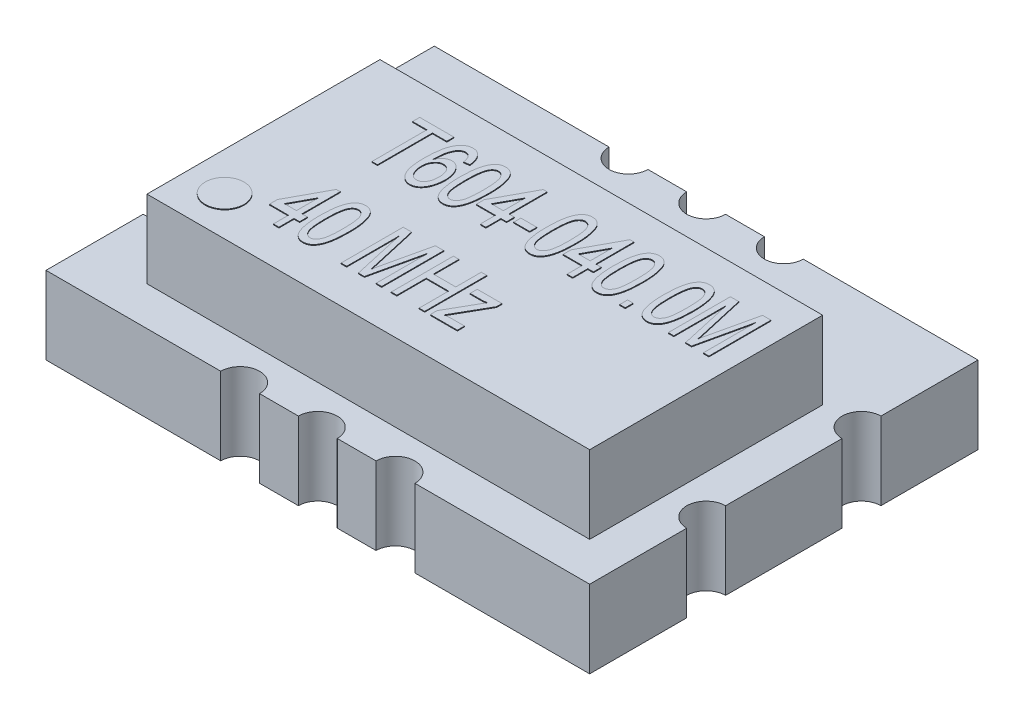
from build123d import *

# Parameters (mm, degrees)
SKETCH_327_W        = 7
SKETCH_327_H        = 5
EXTRUDE_754_DEPTH   = 1
SKETCH_2_R          = 0.25
CUT_EXTRUDE_1_DEPTH = 1
SKETCH_3_W          = 5.7
SKETCH_3_H          = 3
EXTRUDE_1543_DEPTH  = 1
SKETCH_4_R          = 0.25
EXTRUDE_1724_DEPTH  = 0.01
SKETCH_5_W          = 0.205128205
SKETCH_5_H          = 0.092307692
SKETCH_5_W_2        = 0.071794871
SKETCH_5_H_2        = 0.102564102
EXTRUDE_1953_DEPTH  = 0.01


with BuildPart() as part:
    # Sketch 327 → Extrude 754 (new body)
    with BuildSketch(Plane(origin=(0, 0, 0), x_dir=(1, 0, 0), z_dir=(0, 1, 0))):
        Rectangle(SKETCH_327_W, SKETCH_327_H)
    extrude(amount=EXTRUDE_754_DEPTH)

    # Эскиз2 → Вырез-Вытянуть1 (cut)
    with BuildSketch(Plane(origin=(0, 1, 0), x_dir=(1, 0, 0), z_dir=(0, 1, 0))):
        with Locations((0, 2.5)):
            Circle(SKETCH_2_R)
        with Locations((-1, 2.5)):
            Circle(SKETCH_2_R)
        with Locations((1, 2.5)):
            Circle(SKETCH_2_R)
        with Locations((1, -2.5)):
            Circle(SKETCH_2_R)
        with Locations((0, -2.5)):
            Circle(SKETCH_2_R)
        with Locations((-1, -2.5)):
            Circle(SKETCH_2_R)
        with Locations((-3.5, 1)):
            Circle(SKETCH_2_R)
        with Locations((-3.5, -1)):
            Circle(SKETCH_2_R)
        with Locations((3.5, -1)):
            Circle(SKETCH_2_R)
        with Locations((3.5, 1)):
            Circle(SKETCH_2_R)
    extrude(amount=-CUT_EXTRUDE_1_DEPTH, mode=Mode.SUBTRACT)

    # Эскиз3 → Extrude 1543 (add)
    with BuildSketch(Plane(origin=(0, 1, 0), x_dir=(1, 0, 0), z_dir=(0, 1, 0))):
        with Locations((0.15, -0.5)):
            Rectangle(SKETCH_3_W, SKETCH_3_H)
    extrude(amount=EXTRUDE_1543_DEPTH)

    # Эскиз4 → Extrude 1724 (add)
    with BuildSketch(Plane(origin=(0, 2, 0), x_dir=(1, 0, 0), z_dir=(0, 1, 0))):
        with Locations(Location((-2.2, -1.5, 0), (0, 0, 90))):
            Circle(SKETCH_4_R)
    extrude(amount=EXTRUDE_1724_DEPTH)

    # Эскиз5 → Extrude 1953 (add)
    # profile 1 of 16: a face of its own
    with BuildSketch(Plane(origin=(0, 2, 0), x_dir=(1, 0, 0), z_dir=(0, 1, 0))):
        Polygon((-1.605128205, -0.198447222), (-1.605128205, 0.509245086), (-1.78974359, 0.509245086), (-1.78974359, 0.601552778), (-1.348717949, 0.601552778), (-1.348717949, 0.509245086), (-1.533333333, 0.509245086), (-1.533333333, -0.198447222), align=None)
    # profile 2 of 16: a face of its own
    with BuildSketch(Plane(origin=(0, 2, 0), x_dir=(1, 0, 0), z_dir=(0, 1, 0))):
        with BuildLine():
            Line((-0.938461538, 0.396424573), (-1.01025641, 0.386168163))
            add(Edge.make_bspline(
                [(-1.01025641, 0.386168163), (-1.011829196, 0.394959963), (-1.014767432, 0.41138457), (-1.020872344, 0.433881706), (-1.027577261, 0.45278543), (-1.033724764, 0.46337337), (-1.036538462, 0.468219445)],
                knots=[0, 0, 0, 0, 1.235592023, 2.308300062, 3.225713117, 4, 4, 4, 4], degree=3))
            add(Edge.make_bspline(
                [(-1.036538462, 0.468219445), (-1.038875712, 0.471476686), (-1.043418307, 0.477807341), (-1.051163384, 0.486199852), (-1.059342177, 0.493207712), (-1.067780367, 0.499201094), (-1.076784375, 0.503640837), (-1.086196742, 0.506908305), (-1.096018408, 0.508880402), (-1.102715568, 0.509122907), (-1.106089744, 0.509245086)],
                knots=[0, 0, 0, 0, 1.141493082, 2.218563704, 3.243734935, 4.206326421, 5.159243375, 6.093006733, 7.039215068, 8, 8, 8, 8], degree=3))
            add(Edge.make_bspline(
                [(-1.106089744, 0.509245086), (-1.111571841, 0.508981991), (-1.122613654, 0.508452077), (-1.138831945, 0.503604195), (-1.154826806, 0.496246686), (-1.164532351, 0.489180963), (-1.169551282, 0.485527137)],
                knots=[0, 0, 0, 0, 0.951557446, 1.916587267, 2.922625766, 4, 4, 4, 4], degree=3))
            add(Edge.make_bspline(
                [(-1.169551282, 0.485527137), (-1.174146399, 0.479924965), (-1.183822049, 0.468128823), (-1.195746396, 0.447053466), (-1.207022635, 0.422826879), (-1.215022586, 0.400055402), (-1.221030881, 0.379743395), (-1.22474167, 0.362202268), (-1.228126456, 0.342861625), (-1.230808368, 0.321682198), (-1.232838698, 0.298691384), (-1.234412537, 0.273843567), (-1.235582622, 0.247129469), (-1.235790316, 0.228690852), (-1.235897436, 0.219180983)],
                knots=[0, 0, 0, 0, 0.929692342, 1.957595063, 3.100239194, 4.361915913, 5.055045251, 5.821294394, 6.664420891, 7.578132896, 8.563927728, 9.630270748, 10.777792499, 12, 12, 12, 12], degree=3))
            add(Edge.make_bspline(
                [(-1.235897436, 0.219180983), (-1.231663714, 0.227628807), (-1.223502301, 0.24391381), (-1.208487373, 0.265600151), (-1.192238847, 0.284042542), (-1.174524272, 0.298895457), (-1.155859895, 0.310282265), (-1.136770208, 0.318674662), (-1.117084133, 0.323698084), (-1.103766983, 0.324319379), (-1.097115385, 0.324629701)],
                knots=[0, 0, 0, 0, 1.230094978, 2.371273472, 3.426311028, 4.424565397, 5.371321406, 6.266187712, 7.134002212, 8, 8, 8, 8], degree=3))
            add(Edge.make_bspline(
                [(-1.097115385, 0.324629701), (-1.091385412, 0.32441023), (-1.079985835, 0.3239736), (-1.063208262, 0.320581649), (-1.047198176, 0.314599092), (-1.031648282, 0.306828393), (-1.017074624, 0.29632813), (-1.002955788, 0.283914017), (-0.989712602, 0.269021848), (-0.977138015, 0.252148702), (-0.965696154, 0.233468507), (-0.955512792, 0.213358165), (-0.947052029, 0.191826266), (-0.940208844, 0.168968972), (-0.934726973, 0.144885381), (-0.930917511, 0.119442532), (-0.928684932, 0.092672172), (-0.928367375, 0.074366899), (-0.928205128, 0.065014316)],
                knots=[0, 0, 0, 0, 0.803176231, 1.597890533, 2.386936835, 3.194258654, 4.027570185, 4.897800899, 5.825904207, 6.816127502, 7.845138853, 8.893621501, 9.97297987, 11.084300336, 12.236347745, 13.433391822, 14.688661128, 16, 16, 16, 16], degree=3))
            add(Edge.make_bspline(
                [(-0.928205128, 0.065014316), (-0.928474194, 0.052661832), (-0.929003551, 0.028359719), (-0.93343545, -0.007471118), (-0.940771326, -0.041957589), (-0.950963167, -0.074712527), (-0.963369928, -0.105054302), (-0.978244958, -0.132047972), (-0.9954491, -0.15530195), (-1.014934933, -0.174444913), (-1.036017972, -0.189833119), (-1.058846569, -0.200662859), (-1.083031981, -0.2076316), (-1.099739189, -0.208344006), (-1.108173077, -0.208703632)],
                knots=[0, 0, 0, 0, 1.225236238, 2.410513451, 3.575809562, 4.71909413, 5.809677918, 6.82277454, 7.769360828, 8.668837294, 9.52339245, 10.345990864, 11.165047303, 12, 12, 12, 12], degree=3))
            add(Edge.make_bspline(
                [(-1.108173077, -0.208703632), (-1.115351429, -0.208421561), (-1.129511015, -0.207865163), (-1.150250762, -0.203581577), (-1.169945747, -0.196501298), (-1.188575139, -0.186498054), (-1.206340875, -0.174022579), (-1.222762943, -0.158277789), (-1.238289006, -0.139975991), (-1.252857691, -0.118814317), (-1.265893984, -0.094330462), (-1.27723161, -0.066360278), (-1.28653283, -0.034698727), (-1.294360231, 0.000471378), (-1.300347679, 0.03928949), (-1.304531341, 0.081714659), (-1.30736846, 0.127689571), (-1.307581791, 0.159560971), (-1.307692308, 0.176072009)],
                knots=[0, 0, 0, 0, 0.715419718, 1.411193832, 2.102056538, 2.79550207, 3.513831178, 4.259984806, 5.057338898, 5.903989113, 6.816780578, 7.817864891, 8.908225659, 10.103672414, 11.408590738, 12.822241662, 14.353756468, 16, 16, 16, 16], degree=3))
            add(Edge.make_bspline(
                [(-1.307692308, 0.176072009), (-1.307522459, 0.194612442), (-1.307194777, 0.230381828), (-1.304285619, 0.282085233), (-1.299599287, 0.329855175), (-1.292924752, 0.373735612), (-1.284413263, 0.413716779), (-1.273823225, 0.449764945), (-1.261656016, 0.482095305), (-1.251169292, 0.501436943), (-1.246153846, 0.510687393)],
                knots=[0, 0, 0, 0, 1.294341645, 2.497126386, 3.61414508, 4.644286579, 5.594527563, 6.465451546, 7.266077419, 8, 8, 8, 8], degree=3))
            add(Edge.make_bspline(
                [(-1.246153846, 0.510687393), (-1.241674686, 0.517910597), (-1.232991531, 0.531913265), (-1.217553633, 0.550395366), (-1.201275897, 0.566314215), (-1.183535124, 0.579160685), (-1.164643403, 0.589157807), (-1.144622255, 0.596500668), (-1.123358941, 0.600708621), (-1.108832245, 0.601268142), (-1.101442308, 0.601552778)],
                knots=[0, 0, 0, 0, 1.134860032, 2.200002815, 3.210056974, 4.171328071, 5.116848547, 6.058803046, 7.012485358, 8, 8, 8, 8], degree=3))
            add(Edge.make_bspline(
                [(-1.101442308, 0.601552778), (-1.095930444, 0.601413704), (-1.085058337, 0.601139383), (-1.069126879, 0.598520414), (-1.053986766, 0.594153768), (-1.039574617, 0.588231275), (-1.026066383, 0.580442448), (-1.013272652, 0.571040194), (-1.00121839, 0.559931644), (-0.990053651, 0.54709687), (-0.979845892, 0.532774218), (-0.970413964, 0.517225909), (-0.962580188, 0.500135258), (-0.955375355, 0.481946398), (-0.949616762, 0.462382354), (-0.94450336, 0.441619889), (-0.940934017, 0.419470118), (-0.939299152, 0.404231824), (-0.938461538, 0.396424573)],
                knots=[0, 0, 0, 0, 0.912218998, 1.79934439, 2.664498095, 3.517124232, 4.372956603, 5.23991742, 6.141436544, 7.081787579, 8.051513077, 9.051276494, 10.088042922, 11.160755319, 12.288517567, 13.462149164, 14.699746833, 16, 16, 16, 16], degree=3))
        make_face()
        with BuildLine():
            add(Edge.make_bspline(
                [(-1.235897436, 0.06709765), (-1.235728939, 0.059074997), (-1.235395187, 0.043184075), (-1.232218983, 0.019582979), (-1.227086017, -0.003456215), (-1.22017273, -0.025702797), (-1.211480353, -0.046231165), (-1.201611231, -0.064654486), (-1.190136394, -0.080253331), (-1.177663114, -0.093557789), (-1.163510647, -0.10380965), (-1.148033716, -0.111129449), (-1.131232923, -0.115623808), (-1.119579265, -0.116134744), (-1.113621795, -0.11639594)],
                knots=[0, 0, 0, 0, 1.181504839, 2.340273327, 3.501258125, 4.656251808, 5.767206257, 6.781634005, 7.727720866, 8.612747834, 9.458148051, 10.28547701, 11.123518102, 12, 12, 12, 12], degree=3))
            add(Edge.make_bspline(
                [(-1.113621795, -0.11639594), (-1.109390217, -0.116241992), (-1.101132626, -0.115941574), (-1.089080104, -0.113578901), (-1.07760873, -0.109951055), (-1.066837647, -0.104606609), (-1.056792426, -0.097772893), (-1.047401703, -0.08945876), (-1.038602056, -0.079701503), (-1.03063513, -0.068411743), (-1.023408104, -0.055927945), (-1.01726081, -0.042234242), (-1.01165527, -0.027585142), (-1.007475273, -0.011711244), (-1.004093643, 0.005145651), (-1.001709657, 0.023078115), (-1.000262349, 0.042073488), (-1.000088798, 0.055129183), (-1, 0.061809188)],
                knots=[0, 0, 0, 0, 0.861080256, 1.680330439, 2.492180885, 3.304614139, 4.119229206, 4.95937307, 5.85282585, 6.78858546, 7.768147815, 8.785457484, 9.842190834, 10.958443789, 12.12325195, 13.341683336, 14.639860385, 16, 16, 16, 16], degree=3))
            add(Edge.make_bspline(
                [(-1, 0.061809188), (-1.000087221, 0.068222334), (-1.000257535, 0.080745017), (-1.001731125, 0.099044683), (-1.004068763, 0.116287945), (-1.007434603, 0.13246698), (-1.011813689, 0.14753722), (-1.016817361, 0.161727804), (-1.023112596, 0.174747971), (-1.030356278, 0.186621661), (-1.038281172, 0.197415669), (-1.047153193, 0.206725793), (-1.056688122, 0.214781515), (-1.067163819, 0.22113733), (-1.078384015, 0.226258923), (-1.090449371, 0.229635843), (-1.103214499, 0.232074902), (-1.112006853, 0.232238358), (-1.11650641, 0.232322009)],
                knots=[0, 0, 0, 0, 1.326166634, 2.589550243, 3.794180701, 4.923072256, 6.0035695, 7.038071767, 8.03128066, 8.988123825, 9.911733974, 10.794809035, 11.642121678, 12.485318849, 13.321027895, 14.184535643, 15.070921731, 16, 16, 16, 16], degree=3))
            add(Edge.make_bspline(
                [(-1.11650641, 0.232322009), (-1.120578121, 0.232228329), (-1.128679144, 0.232041944), (-1.140496366, 0.229649717), (-1.15188267, 0.226163507), (-1.162728403, 0.221080052), (-1.173171351, 0.214649274), (-1.183155615, 0.206775513), (-1.192469444, 0.197294222), (-1.201385038, 0.18667912), (-1.209498132, 0.174882546), (-1.216638182, 0.162135476), (-1.222468238, 0.148441421), (-1.227608721, 0.133940738), (-1.231102539, 0.118420525), (-1.233854062, 0.102108535), (-1.23572507, 0.084929125), (-1.235839038, 0.073139027), (-1.235897436, 0.06709765)],
                knots=[0, 0, 0, 0, 0.861030244, 1.713094292, 2.543244451, 3.378467327, 4.241946953, 5.136014541, 6.064012714, 7.051937892, 8.068722987, 9.091783043, 10.140605082, 11.217546786, 12.345402713, 13.504158387, 14.721102991, 16, 16, 16, 16], degree=3))
        make_face(mode=Mode.SUBTRACT)
    # profile 3 of 16: a face of its own
    with BuildSketch(Plane(origin=(0, 2, 0), x_dir=(1, 0, 0), z_dir=(0, 1, 0))):
        with BuildLine():
            add(Edge.make_bspline(
                [(-0.866666667, 0.19610406), (-0.866607715, 0.207536401), (-0.86649227, 0.229924495), (-0.865517023, 0.26267772), (-0.863952773, 0.293778365), (-0.861684001, 0.32321856), (-0.858923412, 0.351030879), (-0.855131381, 0.377190833), (-0.851058614, 0.401747804), (-0.846237784, 0.424735737), (-0.840813247, 0.446237194), (-0.834752931, 0.466306417), (-0.827990422, 0.484966089), (-0.820731506, 0.502256583), (-0.812590709, 0.518101388), (-0.804065353, 0.532614897), (-0.794846712, 0.54578887), (-0.784942262, 0.55750832), (-0.774290276, 0.567775796), (-0.763161178, 0.57689283), (-0.751340462, 0.584638511), (-0.738679969, 0.590713907), (-0.725476807, 0.595549996), (-0.711586944, 0.599116322), (-0.697020407, 0.601223186), (-0.687079491, 0.601442066), (-0.682051282, 0.601552778)],
                knots=[0, 0, 0, 0, 1.669823481, 3.270035845, 4.785744591, 6.217787729, 7.582680514, 8.867098694, 10.078006698, 11.218063772, 12.296739467, 13.316132976, 14.27873141, 15.194661726, 16.053086578, 16.878722659, 17.651531939, 18.398829426, 19.116157072, 19.809533213, 20.497753742, 21.174736535, 21.856022228, 22.548651646, 23.265894416, 24, 24, 24, 24], degree=3))
            add(Edge.make_bspline(
                [(-0.682051282, 0.601552778), (-0.674600632, 0.601252276), (-0.659912817, 0.600659883), (-0.638449494, 0.595713083), (-0.618249601, 0.587387487), (-0.599210574, 0.576097718), (-0.581735996, 0.561862116), (-0.566273651, 0.544561349), (-0.553163293, 0.524333007), (-0.542135214, 0.501300983), (-0.532876787, 0.475564703), (-0.524210099, 0.447393057), (-0.516551755, 0.416517134), (-0.511106176, 0.388963961), (-0.506984942, 0.36517875), (-0.504544983, 0.345487101), (-0.502223699, 0.324287066), (-0.500568714, 0.301564654), (-0.499057133, 0.277368745), (-0.498188114, 0.251664187), (-0.497471777, 0.224420056), (-0.497448082, 0.205720007), (-0.497435897, 0.19610406)],
                knots=[0, 0, 0, 0, 0.905706461, 1.785461602, 2.662861046, 3.554538178, 4.469085537, 5.394171541, 6.365756358, 7.391808084, 8.49401013, 9.69047588, 10.976702133, 12.362164475, 13.106869072, 13.91299042, 14.775680142, 15.701313885, 16.684416072, 17.724999256, 18.830148116, 20, 20, 20, 20], degree=3))
            add(Edge.make_bspline(
                [(-0.497435897, 0.19610406), (-0.497494749, 0.184725163), (-0.49760971, 0.162497333), (-0.49858094, 0.130010594), (-0.500169426, 0.099125809), (-0.502388494, 0.069840534), (-0.505253438, 0.042102655), (-0.508754472, 0.015963372), (-0.512905969, -0.008573926), (-0.517660659, -0.031523924), (-0.523202122, -0.052924762), (-0.529023173, -0.073044384), (-0.535724788, -0.091717513), (-0.543123552, -0.109000677), (-0.551176468, -0.124851168), (-0.559566448, -0.139558195), (-0.568900343, -0.15271616), (-0.578887248, -0.164503484), (-0.589446598, -0.174913868), (-0.600570772, -0.184075592), (-0.612537019, -0.191563495), (-0.625089192, -0.197953102), (-0.63843229, -0.202652231), (-0.652351052, -0.206277192), (-0.66697604, -0.208379102), (-0.676969905, -0.208594244), (-0.682051282, -0.208703632)],
                knots=[0, 0, 0, 0, 1.66366773, 3.24985149, 4.751462092, 6.184923882, 7.543400191, 8.8280228, 10.04013039, 11.181316859, 12.25349245, 13.271651562, 14.242550995, 15.152208159, 16.018447801, 16.840943467, 17.625402705, 18.373440501, 19.096937603, 19.791000637, 20.475684009, 21.15679432, 21.846094984, 22.539410555, 23.257363861, 24, 24, 24, 24], degree=3))
            add(Edge.make_bspline(
                [(-0.682051282, -0.208703632), (-0.688688163, -0.208433216), (-0.701736285, -0.207901578), (-0.72077877, -0.204430027), (-0.738598927, -0.198148098), (-0.755479565, -0.189843134), (-0.771123821, -0.17877838), (-0.78554043, -0.165275145), (-0.799261008, -0.149723877), (-0.806836709, -0.137773264), (-0.810737179, -0.131620299)],
                knots=[0, 0, 0, 0, 1.011941422, 1.989479257, 2.937254146, 3.884188933, 4.848921607, 5.845974173, 6.890965276, 8, 8, 8, 8], degree=3))
            add(Edge.make_bspline(
                [(-0.810737179, -0.131620299), (-0.81531011, -0.122408528), (-0.824883682, -0.103123396), (-0.835912244, -0.071206334), (-0.845569496, -0.03577157), (-0.853298396, 0.003441855), (-0.859310176, 0.046353352), (-0.863499206, 0.092993323), (-0.866340941, 0.143291026), (-0.866555612, 0.178097648), (-0.866666667, 0.19610406)],
                knots=[0, 0, 0, 0, 0.735214266, 1.539194114, 2.410789125, 3.362024836, 4.396619495, 5.509850356, 6.711777857, 8, 8, 8, 8], degree=3))
        make_face()
        with BuildLine():
            add(Edge.make_bspline(
                [(-0.794871795, 0.196424573), (-0.794803595, 0.181038254), (-0.794673073, 0.151591845), (-0.793040957, 0.109535689), (-0.790552843, 0.071583051), (-0.787096031, 0.037843582), (-0.782779242, 0.00821545), (-0.777163, -0.017206102), (-0.770915492, -0.038654685), (-0.763021638, -0.056082013), (-0.7543779, -0.070320199), (-0.745677763, -0.082670062), (-0.736122523, -0.092915587), (-0.726366304, -0.101592429), (-0.715998085, -0.108273028), (-0.705126934, -0.113001629), (-0.693731144, -0.115815596), (-0.685966153, -0.11620142), (-0.682051282, -0.11639594)],
                knots=[0, 0, 0, 0, 2.038421423, 3.901140599, 5.575257319, 7.076698452, 8.39394439, 9.539292185, 10.524306942, 11.347851798, 12.065194312, 12.729157401, 13.345222449, 13.917141439, 14.455075582, 14.971779234, 15.48160263, 16, 16, 16, 16], degree=3))
            add(Edge.make_bspline(
                [(-0.682051282, -0.11639594), (-0.678138014, -0.116197628), (-0.670376202, -0.115804284), (-0.658935684, -0.113041163), (-0.648139034, -0.108080009), (-0.637785353, -0.10143579), (-0.627924661, -0.092923953), (-0.618438183, -0.082657388), (-0.609677738, -0.070296867), (-0.601087218, -0.055910771), (-0.593253419, -0.038417444), (-0.586877328, -0.01695655), (-0.581354761, 0.008490547), (-0.577010774, 0.038109907), (-0.573540873, 0.071796189), (-0.571068155, 0.109642766), (-0.56942592, 0.151645114), (-0.569297824, 0.181038215), (-0.569230769, 0.196424573)],
                knots=[0, 0, 0, 0, 0.518500745, 1.028425806, 1.548084997, 2.086126411, 2.65354177, 3.269729669, 3.933825161, 4.657396079, 5.48755883, 6.466007489, 7.618496036, 8.936004649, 10.430704656, 12.105155215, 13.961172091, 16, 16, 16, 16], degree=3))
            add(Edge.make_bspline(
                [(-0.569230769, 0.196424573), (-0.569312872, 0.211490175), (-0.569470131, 0.240346802), (-0.570925466, 0.281599401), (-0.573171053, 0.318925939), (-0.576783995, 0.35226111), (-0.580822926, 0.381746938), (-0.586367495, 0.407185891), (-0.592304918, 0.428829599), (-0.59984459, 0.446710501), (-0.608195611, 0.461499123), (-0.616890232, 0.474248759), (-0.626275076, 0.485003685), (-0.636380631, 0.493804396), (-0.646966816, 0.500870769), (-0.658391012, 0.505694237), (-0.670409495, 0.5087185), (-0.678667917, 0.509067993), (-0.682852564, 0.509245086)],
                knots=[0, 0, 0, 0, 1.990170554, 3.811969306, 5.45259854, 6.928630346, 8.241013068, 9.381533842, 10.36640098, 11.201300277, 11.937458173, 12.606938576, 13.236946156, 13.817162505, 14.373050772, 14.910491544, 15.447932317, 16, 16, 16, 16], degree=3))
            add(Edge.make_bspline(
                [(-0.682852564, 0.509245086), (-0.686767471, 0.509111541), (-0.694472072, 0.508848722), (-0.705773994, 0.506123921), (-0.716505717, 0.501786214), (-0.726831529, 0.495764526), (-0.736339839, 0.487819441), (-0.745490398, 0.478326014), (-0.754107645, 0.467155342), (-0.759114193, 0.458767461), (-0.761698718, 0.454437393)],
                knots=[0, 0, 0, 0, 0.928955705, 1.828200377, 2.745281725, 3.672848337, 4.656333101, 5.679891205, 6.802292342, 8, 8, 8, 8], degree=3))
            add(Edge.make_bspline(
                [(-0.761698718, 0.454437393), (-0.764450873, 0.448023092), (-0.770345101, 0.434285729), (-0.776853283, 0.411070549), (-0.782333073, 0.384329864), (-0.786928002, 0.353887446), (-0.790582966, 0.319777973), (-0.793009832, 0.281922925), (-0.794676487, 0.240403213), (-0.794804887, 0.211490539), (-0.794871795, 0.196424573)],
                knots=[0, 0, 0, 0, 0.639372435, 1.369329365, 2.205018136, 3.141519901, 4.19079776, 5.349312158, 6.618765841, 8, 8, 8, 8], degree=3))
        make_face(mode=Mode.SUBTRACT)
    # profile 4 of 16: a face of its own
    with BuildSketch(Plane(origin=(0, 2, 0), x_dir=(1, 0, 0), z_dir=(0, 1, 0))):
        Polygon((-0.21025641, -0.198447222), (-0.21025641, -0.003575427), (-0.456410256, -0.003575427), (-0.456410256, 0.098988675), (-0.18974359, 0.591296368), (-0.138461538, 0.591296368), (-0.138461538, 0.098988675), (-0.066666667, 0.098988675), (-0.066666667, -0.003575427), (-0.138461538, -0.003575427), (-0.138461538, -0.198447222), align=None)
        Polygon((-0.21025641, 0.098988675), (-0.21025641, 0.385206624), (-0.365384615, 0.098988675), align=None, mode=Mode.SUBTRACT)
    # profile 5 of 16: a face of its own
    with BuildSketch(Plane(origin=(0, 2, 0), x_dir=(1, 0, 0), z_dir=(0, 1, 0))):
        with Locations((0.087179488, 0.08360406)):
            Rectangle(SKETCH_5_W, SKETCH_5_H)
    # profile 6 of 16: a face of its own
    with BuildSketch(Plane(origin=(0, 2, 0), x_dir=(1, 0, 0), z_dir=(0, 1, 0))):
        with BuildLine():
            add(Edge.make_bspline(
                [(0.251282051, 0.19610406), (0.251341003, 0.207536401), (0.251456448, 0.229924495), (0.252431695, 0.26267772), (0.253995945, 0.293778365), (0.256264716, 0.32321856), (0.259025306, 0.351030879), (0.262817337, 0.377190833), (0.266890104, 0.401747804), (0.271710934, 0.424735737), (0.277135471, 0.446237194), (0.283195787, 0.466306417), (0.289958296, 0.484966089), (0.297217212, 0.502256583), (0.305358009, 0.518101388), (0.313883365, 0.532614897), (0.323102006, 0.54578887), (0.333006456, 0.55750832), (0.343658442, 0.567775796), (0.35478754, 0.57689283), (0.366608256, 0.584638511), (0.379268749, 0.590713907), (0.39247191, 0.595549996), (0.406361774, 0.599116322), (0.420928311, 0.601223186), (0.430869227, 0.601442066), (0.435897436, 0.601552778)],
                knots=[0, 0, 0, 0, 1.669823481, 3.270035845, 4.785744591, 6.217787729, 7.582680514, 8.867098694, 10.078006698, 11.218063772, 12.296739467, 13.316132976, 14.27873141, 15.194661726, 16.053086578, 16.878722659, 17.651531939, 18.398829426, 19.116157072, 19.809533213, 20.497753742, 21.174736535, 21.856022228, 22.548651646, 23.265894416, 24, 24, 24, 24], degree=3))
            add(Edge.make_bspline(
                [(0.435897436, 0.601552778), (0.443348086, 0.601252276), (0.458035901, 0.600659883), (0.479499224, 0.595713083), (0.499699117, 0.587387487), (0.518738144, 0.576097718), (0.536212722, 0.561862116), (0.551675067, 0.544561349), (0.564785425, 0.524333007), (0.575813504, 0.501300983), (0.585071931, 0.475564703), (0.593738619, 0.447393057), (0.601396963, 0.416517134), (0.606842542, 0.388963961), (0.610963776, 0.36517875), (0.613403735, 0.345487101), (0.615725019, 0.324287066), (0.617380004, 0.301564654), (0.618891585, 0.277368745), (0.619760604, 0.251664187), (0.620476941, 0.224420056), (0.620500636, 0.205720007), (0.620512821, 0.19610406)],
                knots=[0, 0, 0, 0, 0.905706461, 1.785461602, 2.662861046, 3.554538178, 4.469085537, 5.394171541, 6.365756358, 7.391808084, 8.49401013, 9.69047588, 10.976702133, 12.362164475, 13.106869072, 13.91299042, 14.775680142, 15.701313885, 16.684416072, 17.724999256, 18.830148116, 20, 20, 20, 20], degree=3))
            add(Edge.make_bspline(
                [(0.620512821, 0.19610406), (0.620453969, 0.184725163), (0.620339008, 0.162497333), (0.619367778, 0.130010594), (0.617779292, 0.099125809), (0.615560224, 0.069840534), (0.61269528, 0.042102655), (0.609194246, 0.015963372), (0.605042748, -0.008573926), (0.600288059, -0.031523924), (0.594746596, -0.052924762), (0.588925545, -0.073044384), (0.58222393, -0.091717513), (0.574825166, -0.109000677), (0.56677225, -0.124851168), (0.55838227, -0.139558195), (0.549048375, -0.15271616), (0.53906147, -0.164503484), (0.528502119, -0.174913868), (0.517377946, -0.184075592), (0.505411699, -0.191563495), (0.492859526, -0.197953102), (0.479516428, -0.202652231), (0.465597666, -0.206277192), (0.450972678, -0.208379102), (0.440978813, -0.208594244), (0.435897436, -0.208703632)],
                knots=[0, 0, 0, 0, 1.66366773, 3.24985149, 4.751462092, 6.184923882, 7.543400191, 8.8280228, 10.04013039, 11.181316859, 12.25349245, 13.271651562, 14.242550995, 15.152208159, 16.018447801, 16.840943467, 17.625402705, 18.373440501, 19.096937603, 19.791000637, 20.475684009, 21.15679432, 21.846094984, 22.539410555, 23.257363861, 24, 24, 24, 24], degree=3))
            add(Edge.make_bspline(
                [(0.435897436, -0.208703632), (0.429260555, -0.208433216), (0.416212432, -0.207901578), (0.397169948, -0.204430027), (0.379349791, -0.198148098), (0.362469153, -0.189843134), (0.346824896, -0.17877838), (0.332408288, -0.165275145), (0.31868771, -0.149723877), (0.311112009, -0.137773264), (0.307211538, -0.131620299)],
                knots=[0, 0, 0, 0, 1.011941422, 1.989479257, 2.937254146, 3.884188933, 4.848921607, 5.845974173, 6.890965276, 8, 8, 8, 8], degree=3))
            add(Edge.make_bspline(
                [(0.307211538, -0.131620299), (0.302638608, -0.122408528), (0.293065036, -0.103123396), (0.282036474, -0.071206334), (0.272379222, -0.03577157), (0.264650322, 0.003441855), (0.258638542, 0.046353352), (0.254449512, 0.092993323), (0.251607777, 0.143291026), (0.251393106, 0.178097648), (0.251282051, 0.19610406)],
                knots=[0, 0, 0, 0, 0.735214266, 1.539194114, 2.410789125, 3.362024836, 4.396619495, 5.509850356, 6.711777857, 8, 8, 8, 8], degree=3))
        make_face()
        with BuildLine():
            add(Edge.make_bspline(
                [(0.323076923, 0.196424573), (0.323145123, 0.181038254), (0.323275645, 0.151591845), (0.324907761, 0.109535689), (0.327395875, 0.071583051), (0.330852687, 0.037843582), (0.335169476, 0.00821545), (0.340785718, -0.017206102), (0.347033226, -0.038654685), (0.35492708, -0.056082013), (0.363570818, -0.070320199), (0.372270955, -0.082670062), (0.381826195, -0.092915587), (0.391582414, -0.101592429), (0.401950633, -0.108273028), (0.412821784, -0.113001629), (0.424217574, -0.115815596), (0.431982565, -0.11620142), (0.435897436, -0.11639594)],
                knots=[0, 0, 0, 0, 2.038421423, 3.901140599, 5.575257319, 7.076698452, 8.39394439, 9.539292185, 10.524306942, 11.347851798, 12.065194312, 12.729157401, 13.345222449, 13.917141439, 14.455075582, 14.971779234, 15.48160263, 16, 16, 16, 16], degree=3))
            add(Edge.make_bspline(
                [(0.435897436, -0.11639594), (0.439810703, -0.116197628), (0.447572516, -0.115804284), (0.459013034, -0.113041163), (0.469809684, -0.108080009), (0.480163365, -0.10143579), (0.490024057, -0.092923953), (0.499510535, -0.082657388), (0.50827098, -0.070296867), (0.5168615, -0.055910771), (0.524695299, -0.038417444), (0.53107139, -0.01695655), (0.536593957, 0.008490547), (0.540937944, 0.038109907), (0.544407845, 0.071796189), (0.546880563, 0.109642766), (0.548522798, 0.151645114), (0.548650894, 0.181038215), (0.548717949, 0.196424573)],
                knots=[0, 0, 0, 0, 0.518500745, 1.028425806, 1.548084997, 2.086126411, 2.65354177, 3.269729669, 3.933825161, 4.657396079, 5.48755883, 6.466007489, 7.618496036, 8.936004649, 10.430704656, 12.105155215, 13.961172091, 16, 16, 16, 16], degree=3))
            add(Edge.make_bspline(
                [(0.548717949, 0.196424573), (0.548635846, 0.211490175), (0.548478587, 0.240346802), (0.547023252, 0.281599401), (0.544777665, 0.318925939), (0.541164723, 0.35226111), (0.537125792, 0.381746938), (0.531581223, 0.407185891), (0.5256438, 0.428829599), (0.518104128, 0.446710501), (0.509753107, 0.461499123), (0.501058486, 0.474248759), (0.491673642, 0.485003685), (0.481568087, 0.493804396), (0.470981902, 0.500870769), (0.459557706, 0.505694237), (0.447539223, 0.5087185), (0.439280801, 0.509067993), (0.435096154, 0.509245086)],
                knots=[0, 0, 0, 0, 1.990170554, 3.811969306, 5.45259854, 6.928630346, 8.241013068, 9.381533842, 10.36640098, 11.201300277, 11.937458173, 12.606938576, 13.236946156, 13.817162505, 14.373050772, 14.910491544, 15.447932317, 16, 16, 16, 16], degree=3))
            add(Edge.make_bspline(
                [(0.435096154, 0.509245086), (0.431181247, 0.509111541), (0.423476646, 0.508848722), (0.412174724, 0.506123921), (0.401443, 0.501786214), (0.391117189, 0.495764526), (0.381608879, 0.487819441), (0.37245832, 0.478326014), (0.363841073, 0.467155342), (0.358834525, 0.458767461), (0.35625, 0.454437393)],
                knots=[0, 0, 0, 0, 0.928955705, 1.828200377, 2.745281725, 3.672848337, 4.656333101, 5.679891205, 6.802292342, 8, 8, 8, 8], degree=3))
            add(Edge.make_bspline(
                [(0.35625, 0.454437393), (0.353497845, 0.448023092), (0.347603617, 0.434285729), (0.341095435, 0.411070549), (0.335615645, 0.384329864), (0.331020716, 0.353887446), (0.327365752, 0.319777973), (0.324938886, 0.281922925), (0.323272231, 0.240403213), (0.323143831, 0.211490539), (0.323076923, 0.196424573)],
                knots=[0, 0, 0, 0, 0.639372435, 1.369329365, 2.205018136, 3.141519901, 4.19079776, 5.349312158, 6.618765841, 8, 8, 8, 8], degree=3))
        make_face(mode=Mode.SUBTRACT)
    # profile 7 of 16: a face of its own
    with BuildSketch(Plane(origin=(0, 2, 0), x_dir=(1, 0, 0), z_dir=(0, 1, 0))):
        Polygon((0.907692308, -0.198447222), (0.907692308, -0.003575427), (0.661538462, -0.003575427), (0.661538462, 0.098988675), (0.928205128, 0.591296368), (0.979487179, 0.591296368), (0.979487179, 0.098988675), (1.051282051, 0.098988675), (1.051282051, -0.003575427), (0.979487179, -0.003575427), (0.979487179, -0.198447222), align=None)
        Polygon((0.907692308, 0.098988675), (0.907692308, 0.385206624), (0.752564103, 0.098988675), align=None, mode=Mode.SUBTRACT)
    # profile 8 of 16: a face of its own
    with BuildSketch(Plane(origin=(0, 2, 0), x_dir=(1, 0, 0), z_dir=(0, 1, 0))):
        with BuildLine():
            add(Edge.make_bspline(
                [(1.112820513, 0.19610406), (1.112879464, 0.207536401), (1.11299491, 0.229924495), (1.113970157, 0.26267772), (1.115534407, 0.293778365), (1.117803178, 0.32321856), (1.120563768, 0.351030879), (1.124355798, 0.377190833), (1.128428566, 0.401747804), (1.133249395, 0.424735737), (1.138673932, 0.446237194), (1.144734248, 0.466306417), (1.151496758, 0.484966089), (1.158755674, 0.502256583), (1.16689647, 0.518101388), (1.175421827, 0.532614897), (1.184640468, 0.54578887), (1.194544918, 0.55750832), (1.205196903, 0.567775796), (1.216326002, 0.57689283), (1.228146718, 0.584638511), (1.24080721, 0.590713907), (1.254010372, 0.595549996), (1.267900235, 0.599116322), (1.282466773, 0.601223186), (1.292407689, 0.601442066), (1.297435897, 0.601552778)],
                knots=[0, 0, 0, 0, 1.669823481, 3.270035845, 4.785744591, 6.217787729, 7.582680514, 8.867098694, 10.078006698, 11.218063772, 12.296739467, 13.316132976, 14.27873141, 15.194661726, 16.053086578, 16.878722659, 17.651531939, 18.398829426, 19.116157072, 19.809533213, 20.497753742, 21.174736535, 21.856022228, 22.548651646, 23.265894416, 24, 24, 24, 24], degree=3))
            add(Edge.make_bspline(
                [(1.297435897, 0.601552778), (1.304886547, 0.601252276), (1.319574362, 0.600659883), (1.341037686, 0.595713083), (1.361237579, 0.587387487), (1.380276605, 0.576097718), (1.397751183, 0.561862116), (1.413213528, 0.544561349), (1.426323887, 0.524333007), (1.437351965, 0.501300983), (1.446610393, 0.475564703), (1.455277081, 0.447393057), (1.462935424, 0.416517134), (1.468381004, 0.388963961), (1.472502237, 0.36517875), (1.474942197, 0.345487101), (1.477263481, 0.324287066), (1.478918466, 0.301564654), (1.480430047, 0.277368745), (1.481299066, 0.251664187), (1.482015402, 0.224420056), (1.482039097, 0.205720007), (1.482051282, 0.19610406)],
                knots=[0, 0, 0, 0, 0.905706461, 1.785461602, 2.662861046, 3.554538178, 4.469085537, 5.394171541, 6.365756358, 7.391808084, 8.49401013, 9.69047588, 10.976702133, 12.362164475, 13.106869072, 13.91299042, 14.775680142, 15.701313885, 16.684416072, 17.724999256, 18.830148116, 20, 20, 20, 20], degree=3))
            add(Edge.make_bspline(
                [(1.482051282, 0.19610406), (1.481992431, 0.184725163), (1.481877469, 0.162497333), (1.480906239, 0.130010594), (1.479317754, 0.099125809), (1.477098685, 0.069840534), (1.474233742, 0.042102655), (1.470732707, 0.015963372), (1.46658121, -0.008573926), (1.461826521, -0.031523924), (1.456285058, -0.052924762), (1.450464007, -0.073044384), (1.443762391, -0.091717513), (1.436363628, -0.109000677), (1.428310711, -0.124851168), (1.419920732, -0.139558195), (1.410586836, -0.15271616), (1.400599931, -0.164503484), (1.390040581, -0.174913868), (1.378916407, -0.184075592), (1.366950161, -0.191563495), (1.354397987, -0.197953102), (1.341054889, -0.202652231), (1.327136128, -0.206277192), (1.31251114, -0.208379102), (1.302517274, -0.208594244), (1.297435897, -0.208703632)],
                knots=[0, 0, 0, 0, 1.66366773, 3.24985149, 4.751462092, 6.184923882, 7.543400191, 8.8280228, 10.04013039, 11.181316859, 12.25349245, 13.271651562, 14.242550995, 15.152208159, 16.018447801, 16.840943467, 17.625402705, 18.373440501, 19.096937603, 19.791000637, 20.475684009, 21.15679432, 21.846094984, 22.539410555, 23.257363861, 24, 24, 24, 24], degree=3))
            add(Edge.make_bspline(
                [(1.297435897, -0.208703632), (1.290799017, -0.208433216), (1.277750894, -0.207901578), (1.258708409, -0.204430027), (1.240888253, -0.198148098), (1.224007614, -0.189843134), (1.208363358, -0.17877838), (1.19394675, -0.165275145), (1.180226171, -0.149723877), (1.172650471, -0.137773264), (1.16875, -0.131620299)],
                knots=[0, 0, 0, 0, 1.011941422, 1.989479257, 2.937254146, 3.884188933, 4.848921607, 5.845974173, 6.890965276, 8, 8, 8, 8], degree=3))
            add(Edge.make_bspline(
                [(1.16875, -0.131620299), (1.16417707, -0.122408528), (1.154603498, -0.103123396), (1.143574935, -0.071206334), (1.133917683, -0.03577157), (1.126188784, 0.003441855), (1.120177003, 0.046353352), (1.115987974, 0.092993323), (1.113146239, 0.143291026), (1.112931568, 0.178097648), (1.112820513, 0.19610406)],
                knots=[0, 0, 0, 0, 0.735214266, 1.539194114, 2.410789125, 3.362024836, 4.396619495, 5.509850356, 6.711777857, 8, 8, 8, 8], degree=3))
        make_face()
        with BuildLine():
            add(Edge.make_bspline(
                [(1.184615385, 0.196424573), (1.184683585, 0.181038254), (1.184814107, 0.151591845), (1.186446222, 0.109535689), (1.188934336, 0.071583051), (1.192391148, 0.037843582), (1.196707937, 0.00821545), (1.20232418, -0.017206102), (1.208571688, -0.038654685), (1.216465542, -0.056082013), (1.225109279, -0.070320199), (1.233809416, -0.082670062), (1.243364656, -0.092915587), (1.253120876, -0.101592429), (1.263489095, -0.108273028), (1.274360245, -0.113001629), (1.285756036, -0.115815596), (1.293521027, -0.11620142), (1.297435897, -0.11639594)],
                knots=[0, 0, 0, 0, 2.038421423, 3.901140599, 5.575257319, 7.076698452, 8.39394439, 9.539292185, 10.524306942, 11.347851798, 12.065194312, 12.729157401, 13.345222449, 13.917141439, 14.455075582, 14.971779234, 15.48160263, 16, 16, 16, 16], degree=3))
            add(Edge.make_bspline(
                [(1.297435897, -0.11639594), (1.301349165, -0.116197628), (1.309110977, -0.115804284), (1.320551495, -0.113041163), (1.331348145, -0.108080009), (1.341701826, -0.10143579), (1.351562519, -0.092923953), (1.361048997, -0.082657388), (1.369809442, -0.070296867), (1.378399962, -0.055910771), (1.386233761, -0.038417444), (1.392609851, -0.01695655), (1.398132419, 0.008490547), (1.402476406, 0.038109907), (1.405946306, 0.071796189), (1.408419025, 0.109642766), (1.410061259, 0.151645114), (1.410189356, 0.181038215), (1.41025641, 0.196424573)],
                knots=[0, 0, 0, 0, 0.518500745, 1.028425806, 1.548084997, 2.086126411, 2.65354177, 3.269729669, 3.933825161, 4.657396079, 5.48755883, 6.466007489, 7.618496036, 8.936004649, 10.430704656, 12.105155215, 13.961172091, 16, 16, 16, 16], degree=3))
            add(Edge.make_bspline(
                [(1.41025641, 0.196424573), (1.410174308, 0.211490175), (1.410017049, 0.240346802), (1.408561714, 0.281599401), (1.406316126, 0.318925939), (1.402703184, 0.35226111), (1.398664254, 0.381746938), (1.393119685, 0.407185891), (1.387182262, 0.428829599), (1.379642589, 0.446710501), (1.371291569, 0.461499123), (1.362596947, 0.474248759), (1.353212103, 0.485003685), (1.343106548, 0.493804396), (1.332520364, 0.500870769), (1.321096168, 0.505694237), (1.309077685, 0.5087185), (1.300819262, 0.509067993), (1.296634615, 0.509245086)],
                knots=[0, 0, 0, 0, 1.990170554, 3.811969306, 5.45259854, 6.928630346, 8.241013068, 9.381533842, 10.36640098, 11.201300277, 11.937458173, 12.606938576, 13.236946156, 13.817162505, 14.373050772, 14.910491544, 15.447932317, 16, 16, 16, 16], degree=3))
            add(Edge.make_bspline(
                [(1.296634615, 0.509245086), (1.292719709, 0.509111541), (1.285015107, 0.508848722), (1.273713185, 0.506123921), (1.262981462, 0.501786214), (1.252655651, 0.495764526), (1.24314734, 0.487819441), (1.233996782, 0.478326014), (1.225379534, 0.467155342), (1.220372987, 0.458767461), (1.217788462, 0.454437393)],
                knots=[0, 0, 0, 0, 0.928955705, 1.828200377, 2.745281725, 3.672848337, 4.656333101, 5.679891205, 6.802292342, 8, 8, 8, 8], degree=3))
            add(Edge.make_bspline(
                [(1.217788462, 0.454437393), (1.215036306, 0.448023092), (1.209142078, 0.434285729), (1.202633896, 0.411070549), (1.197154107, 0.384329864), (1.192559177, 0.353887446), (1.188904213, 0.319777973), (1.186477347, 0.281922925), (1.184810693, 0.240403213), (1.184682292, 0.211490539), (1.184615385, 0.196424573)],
                knots=[0, 0, 0, 0, 0.639372435, 1.369329365, 2.205018136, 3.141519901, 4.19079776, 5.349312158, 6.618765841, 8, 8, 8, 8], degree=3))
        make_face(mode=Mode.SUBTRACT)
    # profile 9 of 16: a face of its own
    with BuildSketch(Plane(origin=(0, 2, 0), x_dir=(1, 0, 0), z_dir=(0, 1, 0))):
        with Locations((1.620512821, -0.147165171)):
            Rectangle(SKETCH_5_W_2, SKETCH_5_H_2)
    # profile 10 of 16: a face of its own
    with BuildSketch(Plane(origin=(0, 2, 0), x_dir=(1, 0, 0), z_dir=(0, 1, 0))):
        with BuildLine():
            add(Edge.make_bspline(
                [(1.758974359, 0.19610406), (1.75903331, 0.207536401), (1.759148756, 0.229924495), (1.760124003, 0.26267772), (1.761688253, 0.293778365), (1.763957024, 0.32321856), (1.766717614, 0.351030879), (1.770509645, 0.377190833), (1.774582412, 0.401747804), (1.779403241, 0.424735737), (1.784827778, 0.446237194), (1.790888094, 0.466306417), (1.797650604, 0.484966089), (1.80490952, 0.502256583), (1.813050316, 0.518101388), (1.821575673, 0.532614897), (1.830794314, 0.54578887), (1.840698764, 0.55750832), (1.85135075, 0.567775796), (1.862479848, 0.57689283), (1.874300564, 0.584638511), (1.886961056, 0.590713907), (1.900164218, 0.595549996), (1.914054081, 0.599116322), (1.928620619, 0.601223186), (1.938561535, 0.601442066), (1.943589744, 0.601552778)],
                knots=[0, 0, 0, 0, 1.669823481, 3.270035845, 4.785744591, 6.217787729, 7.582680514, 8.867098694, 10.078006698, 11.218063772, 12.296739467, 13.316132976, 14.27873141, 15.194661726, 16.053086578, 16.878722659, 17.651531939, 18.398829426, 19.116157072, 19.809533213, 20.497753742, 21.174736535, 21.856022228, 22.548651646, 23.265894416, 24, 24, 24, 24], degree=3))
            add(Edge.make_bspline(
                [(1.943589744, 0.601552778), (1.951040393, 0.601252276), (1.965728208, 0.600659883), (1.987191532, 0.595713083), (2.007391425, 0.587387487), (2.026430452, 0.576097718), (2.043905029, 0.561862116), (2.059367374, 0.544561349), (2.072477733, 0.524333007), (2.083505812, 0.501300983), (2.092764239, 0.475564703), (2.101430927, 0.447393057), (2.10908927, 0.416517134), (2.11453485, 0.388963961), (2.118656083, 0.36517875), (2.121096043, 0.345487101), (2.123417327, 0.324287066), (2.125072312, 0.301564654), (2.126583893, 0.277368745), (2.127452912, 0.251664187), (2.128169248, 0.224420056), (2.128192944, 0.205720007), (2.128205128, 0.19610406)],
                knots=[0, 0, 0, 0, 0.905706461, 1.785461602, 2.662861046, 3.554538178, 4.469085537, 5.394171541, 6.365756358, 7.391808084, 8.49401013, 9.69047588, 10.976702133, 12.362164475, 13.106869072, 13.91299042, 14.775680142, 15.701313885, 16.684416072, 17.724999256, 18.830148116, 20, 20, 20, 20], degree=3))
            add(Edge.make_bspline(
                [(2.128205128, 0.19610406), (2.128146277, 0.184725163), (2.128031315, 0.162497333), (2.127060085, 0.130010594), (2.1254716, 0.099125809), (2.123252532, 0.069840534), (2.120387588, 0.042102655), (2.116886553, 0.015963372), (2.112735056, -0.008573926), (2.107980367, -0.031523924), (2.102438904, -0.052924762), (2.096617853, -0.073044384), (2.089916237, -0.091717513), (2.082517474, -0.109000677), (2.074464557, -0.124851168), (2.066074578, -0.139558195), (2.056740682, -0.15271616), (2.046753777, -0.164503484), (2.036194427, -0.174913868), (2.025070253, -0.184075592), (2.013104007, -0.191563495), (2.000551833, -0.197953102), (1.987208736, -0.202652231), (1.973289974, -0.206277192), (1.958664986, -0.208379102), (1.948671121, -0.208594244), (1.943589744, -0.208703632)],
                knots=[0, 0, 0, 0, 1.66366773, 3.24985149, 4.751462092, 6.184923882, 7.543400191, 8.8280228, 10.04013039, 11.181316859, 12.25349245, 13.271651562, 14.242550995, 15.152208159, 16.018447801, 16.840943467, 17.625402705, 18.373440501, 19.096937603, 19.791000637, 20.475684009, 21.15679432, 21.846094984, 22.539410555, 23.257363861, 24, 24, 24, 24], degree=3))
            add(Edge.make_bspline(
                [(1.943589744, -0.208703632), (1.936952863, -0.208433216), (1.92390474, -0.207901578), (1.904862255, -0.204430027), (1.887042099, -0.198148098), (1.870161461, -0.189843134), (1.854517204, -0.17877838), (1.840100596, -0.165275145), (1.826380017, -0.149723877), (1.818804317, -0.137773264), (1.814903846, -0.131620299)],
                knots=[0, 0, 0, 0, 1.011941422, 1.989479257, 2.937254146, 3.884188933, 4.848921607, 5.845974173, 6.890965276, 8, 8, 8, 8], degree=3))
            add(Edge.make_bspline(
                [(1.814903846, -0.131620299), (1.810330916, -0.122408528), (1.800757344, -0.103123396), (1.789728781, -0.071206334), (1.78007153, -0.03577157), (1.77234263, 0.003441855), (1.766330849, 0.046353352), (1.76214182, 0.092993323), (1.759300085, 0.143291026), (1.759085414, 0.178097648), (1.758974359, 0.19610406)],
                knots=[0, 0, 0, 0, 0.735214266, 1.539194114, 2.410789125, 3.362024836, 4.396619495, 5.509850356, 6.711777857, 8, 8, 8, 8], degree=3))
        make_face()
        with BuildLine():
            add(Edge.make_bspline(
                [(1.830769231, 0.196424573), (1.830837431, 0.181038254), (1.830967953, 0.151591845), (1.832600069, 0.109535689), (1.835088182, 0.071583051), (1.838544994, 0.037843582), (1.842861784, 0.00821545), (1.848478026, -0.017206102), (1.854725534, -0.038654685), (1.862619388, -0.056082013), (1.871263125, -0.070320199), (1.879963262, -0.082670062), (1.889518503, -0.092915587), (1.899274722, -0.101592429), (1.909642941, -0.108273028), (1.920514091, -0.113001629), (1.931909882, -0.115815596), (1.939674873, -0.11620142), (1.943589744, -0.11639594)],
                knots=[0, 0, 0, 0, 2.038421423, 3.901140599, 5.575257319, 7.076698452, 8.39394439, 9.539292185, 10.524306942, 11.347851798, 12.065194312, 12.729157401, 13.345222449, 13.917141439, 14.455075582, 14.971779234, 15.48160263, 16, 16, 16, 16], degree=3))
            add(Edge.make_bspline(
                [(1.943589744, -0.11639594), (1.947503011, -0.116197628), (1.955264823, -0.115804284), (1.966705342, -0.113041163), (1.977501991, -0.108080009), (1.987855672, -0.10143579), (1.997716365, -0.092923953), (2.007202843, -0.082657388), (2.015963288, -0.070296867), (2.024553808, -0.055910771), (2.032387607, -0.038417444), (2.038763698, -0.01695655), (2.044286265, 0.008490547), (2.048630252, 0.038109907), (2.052100152, 0.071796189), (2.054572871, 0.109642766), (2.056215105, 0.151645114), (2.056343202, 0.181038215), (2.056410256, 0.196424573)],
                knots=[0, 0, 0, 0, 0.518500745, 1.028425806, 1.548084997, 2.086126411, 2.65354177, 3.269729669, 3.933825161, 4.657396079, 5.48755883, 6.466007489, 7.618496036, 8.936004649, 10.430704656, 12.105155215, 13.961172091, 16, 16, 16, 16], degree=3))
            add(Edge.make_bspline(
                [(2.056410256, 0.196424573), (2.056328154, 0.211490175), (2.056170895, 0.240346802), (2.05471556, 0.281599401), (2.052469972, 0.318925939), (2.04885703, 0.35226111), (2.0448181, 0.381746938), (2.039273531, 0.407185891), (2.033336108, 0.428829599), (2.025796435, 0.446710501), (2.017445415, 0.461499123), (2.008750793, 0.474248759), (1.999365949, 0.485003685), (1.989260394, 0.493804396), (1.97867421, 0.500870769), (1.967250014, 0.505694237), (1.955231531, 0.5087185), (1.946973108, 0.509067993), (1.942788462, 0.509245086)],
                knots=[0, 0, 0, 0, 1.990170554, 3.811969306, 5.45259854, 6.928630346, 8.241013068, 9.381533842, 10.36640098, 11.201300277, 11.937458173, 12.606938576, 13.236946156, 13.817162505, 14.373050772, 14.910491544, 15.447932317, 16, 16, 16, 16], degree=3))
            add(Edge.make_bspline(
                [(1.942788462, 0.509245086), (1.938873555, 0.509111541), (1.931168953, 0.508848722), (1.919867031, 0.506123921), (1.909135308, 0.501786214), (1.898809497, 0.495764526), (1.889301186, 0.487819441), (1.880150628, 0.478326014), (1.87153338, 0.467155342), (1.866526833, 0.458767461), (1.863942308, 0.454437393)],
                knots=[0, 0, 0, 0, 0.928955705, 1.828200377, 2.745281725, 3.672848337, 4.656333101, 5.679891205, 6.802292342, 8, 8, 8, 8], degree=3))
            add(Edge.make_bspline(
                [(1.863942308, 0.454437393), (1.861190152, 0.448023092), (1.855295924, 0.434285729), (1.848787743, 0.411070549), (1.843307953, 0.384329864), (1.838713024, 0.353887446), (1.835058059, 0.319777973), (1.832631193, 0.281922925), (1.830964539, 0.240403213), (1.830836138, 0.211490539), (1.830769231, 0.196424573)],
                knots=[0, 0, 0, 0, 0.639372435, 1.369329365, 2.205018136, 3.141519901, 4.19079776, 5.349312158, 6.618765841, 8, 8, 8, 8], degree=3))
        make_face(mode=Mode.SUBTRACT)
    # profile 11 of 16: a face of its own
    with BuildSketch(Plane(origin=(0, 2, 0), x_dir=(1, 0, 0), z_dir=(0, 1, 0))):
        with BuildLine():
            Line((2.21025641, -0.198447222), (2.21025641, 0.601552778))
            Line((2.21025641, 0.601552778), (2.318429487, 0.601552778))
            Line((2.318429487, 0.601552778), (2.44599359, 0.040174573))
            add(Edge.make_bspline(
                [(2.44599359, 0.040174573), (2.447437979, 0.033818207), (2.450229172, 0.021534916), (2.45423584, 0.003746482), (2.457921734, -0.012759961), (2.461305077, -0.028033845), (2.464356466, -0.042081771), (2.467001256, -0.05493092), (2.469698299, -0.066471704), (2.471121313, -0.073816732), (2.471794872, -0.077293376)],
                knots=[0, 0, 0, 0, 1.300740821, 2.513602354, 3.63858812, 4.675702536, 5.635368143, 6.507182505, 7.293400302, 8, 8, 8, 8], degree=3))
            add(Edge.make_bspline(
                [(2.471794872, -0.077293376), (2.472596076, -0.073500627), (2.474300271, -0.06543329), (2.476989327, -0.052711995), (2.480047443, -0.038718982), (2.483473507, -0.023519544), (2.486879546, -0.006963572), (2.491023991, 0.010770932), (2.495065404, 0.029893056), (2.498107421, 0.043010877), (2.499679487, 0.049789957)],
                knots=[0, 0, 0, 0, 0.715055834, 1.520953921, 2.398431686, 3.357131795, 4.394956568, 5.51611588, 6.716368258, 8, 8, 8, 8], degree=3))
            Line((2.499679487, 0.049789957), (2.625160256, 0.601552778))
            Line((2.625160256, 0.601552778), (2.733333333, 0.601552778))
            Line((2.733333333, 0.601552778), (2.733333333, -0.198447222))
            Line((2.733333333, -0.198447222), (2.661538462, -0.198447222))
            Line((2.661538462, -0.198447222), (2.661538462, 0.478475855))
            Line((2.661538462, 0.478475855), (2.510096154, -0.198447222))
            Line((2.510096154, -0.198447222), (2.43349359, -0.198447222))
            Line((2.43349359, -0.198447222), (2.282051282, 0.478475855))
            Line((2.282051282, 0.478475855), (2.282051282, -0.198447222))
            Line((2.282051282, -0.198447222), (2.21025641, -0.198447222))
        make_face()
    # profile 12 of 16: a face of its own
    with BuildSketch(Plane(origin=(0, 2, 0), x_dir=(1, 0, 0), z_dir=(0, 1, 0))):
        Polygon((-1.543589744, -1.529216453), (-1.543589744, -1.334344658), (-1.78974359, -1.334344658), (-1.78974359, -1.231780555), (-1.523076923, -0.739472863), (-1.471794872, -0.739472863), (-1.471794872, -1.231780555), (-1.4, -1.231780555), (-1.4, -1.334344658), (-1.471794872, -1.334344658), (-1.471794872, -1.529216453), align=None)
        Polygon((-1.543589744, -1.231780555), (-1.543589744, -0.945562607), (-1.698717949, -1.231780555), align=None, mode=Mode.SUBTRACT)
    # profile 13 of 16: a face of its own
    with BuildSketch(Plane(origin=(0, 2, 0), x_dir=(1, 0, 0), z_dir=(0, 1, 0))):
        with BuildLine():
            add(Edge.make_bspline(
                [(-1.338461538, -1.134665171), (-1.338402587, -1.12323283), (-1.338287142, -1.100844736), (-1.337311894, -1.068091511), (-1.335747644, -1.036990866), (-1.333478873, -1.007550671), (-1.330718283, -0.979738352), (-1.326926253, -0.953578398), (-1.322853486, -0.929021427), (-1.318032656, -0.906033494), (-1.312608119, -0.884532037), (-1.306547803, -0.864462814), (-1.299785294, -0.845803142), (-1.292526378, -0.828512648), (-1.284385581, -0.812667842), (-1.275860224, -0.798154333), (-1.266641583, -0.784980361), (-1.256737134, -0.773260911), (-1.246085148, -0.762993435), (-1.234956049, -0.753876401), (-1.223135333, -0.74613072), (-1.210474841, -0.740055324), (-1.197271679, -0.735219234), (-1.183381816, -0.731652909), (-1.168815279, -0.729546045), (-1.158874362, -0.729327164), (-1.153846154, -0.729216453)],
                knots=[0, 0, 0, 0, 1.669823481, 3.270035845, 4.785744591, 6.217787729, 7.582680514, 8.867098694, 10.078006698, 11.218063772, 12.296739467, 13.316132976, 14.27873141, 15.194661726, 16.053086578, 16.878722659, 17.651531939, 18.398829426, 19.116157072, 19.809533213, 20.497753742, 21.174736535, 21.856022228, 22.548651646, 23.265894416, 24, 24, 24, 24], degree=3))
            add(Edge.make_bspline(
                [(-1.153846154, -0.729216453), (-1.146395504, -0.729516955), (-1.131707689, -0.730109348), (-1.110244365, -0.735056148), (-1.090044472, -0.743381744), (-1.071005446, -0.754671513), (-1.053530868, -0.768907115), (-1.038068523, -0.786207882), (-1.024958164, -0.806436223), (-1.013930086, -0.829468248), (-1.004671659, -0.855204528), (-0.99600497, -0.883376174), (-0.988346627, -0.914252097), (-0.982901048, -0.94180527), (-0.978779814, -0.965590481), (-0.976339855, -0.98528213), (-0.974018571, -1.006482165), (-0.972363585, -1.029204577), (-0.970852005, -1.053400486), (-0.969982985, -1.079105044), (-0.969266649, -1.106349175), (-0.969242954, -1.125049224), (-0.969230769, -1.134665171)],
                knots=[0, 0, 0, 0, 0.905706461, 1.785461602, 2.662861046, 3.554538178, 4.469085537, 5.394171541, 6.365756358, 7.391808084, 8.49401013, 9.69047588, 10.976702133, 12.362164475, 13.106869072, 13.91299042, 14.775680142, 15.701313885, 16.684416072, 17.724999256, 18.830148116, 20, 20, 20, 20], degree=3))
            add(Edge.make_bspline(
                [(-0.969230769, -1.134665171), (-0.96928962, -1.146044067), (-0.969404582, -1.168271898), (-0.970375812, -1.200758637), (-0.971964298, -1.231643422), (-0.974183366, -1.260928696), (-0.97704831, -1.288666576), (-0.980549344, -1.314805859), (-0.984700841, -1.339343157), (-0.98945553, -1.362293155), (-0.994996993, -1.383693993), (-1.000818045, -1.403813614), (-1.00751966, -1.422486743), (-1.014918424, -1.439769908), (-1.02297134, -1.455620399), (-1.031361319, -1.470327426), (-1.040695215, -1.483485391), (-1.05068212, -1.495272715), (-1.06124147, -1.505683098), (-1.072365644, -1.514844822), (-1.08433189, -1.522332726), (-1.096884064, -1.528722333), (-1.110227162, -1.533421461), (-1.124145924, -1.537046423), (-1.138770911, -1.539148332), (-1.148764777, -1.539363474), (-1.153846154, -1.539472863)],
                knots=[0, 0, 0, 0, 1.66366773, 3.24985149, 4.751462092, 6.184923882, 7.543400191, 8.8280228, 10.04013039, 11.181316859, 12.25349245, 13.271651562, 14.242550995, 15.152208159, 16.018447801, 16.840943467, 17.625402705, 18.373440501, 19.096937603, 19.791000637, 20.475684009, 21.15679432, 21.846094984, 22.539410555, 23.257363861, 24, 24, 24, 24], degree=3))
            add(Edge.make_bspline(
                [(-1.153846154, -1.539472863), (-1.160483034, -1.539202447), (-1.173531157, -1.538670809), (-1.192573642, -1.535199258), (-1.210393799, -1.528917329), (-1.227274437, -1.520612365), (-1.242918693, -1.509547611), (-1.257335302, -1.496044376), (-1.27105588, -1.480493108), (-1.27863158, -1.468542495), (-1.282532051, -1.46238953)],
                knots=[0, 0, 0, 0, 1.011941422, 1.989479257, 2.937254146, 3.884188933, 4.848921607, 5.845974173, 6.890965276, 8, 8, 8, 8], degree=3))
            add(Edge.make_bspline(
                [(-1.282532051, -1.46238953), (-1.287104981, -1.453177759), (-1.296678554, -1.433892627), (-1.307707116, -1.401975565), (-1.317364368, -1.366540801), (-1.325093268, -1.327327376), (-1.331105048, -1.284415879), (-1.335294078, -1.237775907), (-1.338135813, -1.187478205), (-1.338350483, -1.152671583), (-1.338461538, -1.134665171)],
                knots=[0, 0, 0, 0, 0.735214266, 1.539194114, 2.410789125, 3.362024836, 4.396619495, 5.509850356, 6.711777857, 8, 8, 8, 8], degree=3))
        make_face()
        with BuildLine():
            add(Edge.make_bspline(
                [(-1.266666667, -1.134344658), (-1.266598466, -1.149730976), (-1.266467945, -1.179177386), (-1.264835829, -1.221233541), (-1.262347715, -1.25918618), (-1.258890903, -1.292925649), (-1.254574114, -1.322553781), (-1.248957872, -1.347975333), (-1.242710363, -1.369423916), (-1.23481651, -1.386851244), (-1.226172772, -1.40108943), (-1.217472635, -1.413439293), (-1.207917395, -1.423684817), (-1.198161175, -1.43236166), (-1.187792957, -1.439042259), (-1.176921806, -1.44377086), (-1.165526016, -1.446584827), (-1.157761024, -1.44697065), (-1.153846154, -1.447165171)],
                knots=[0, 0, 0, 0, 2.038421423, 3.901140599, 5.575257319, 7.076698452, 8.39394439, 9.539292185, 10.524306942, 11.347851798, 12.065194312, 12.729157401, 13.345222449, 13.917141439, 14.455075582, 14.971779234, 15.48160263, 16, 16, 16, 16], degree=3))
            add(Edge.make_bspline(
                [(-1.153846154, -1.447165171), (-1.149932886, -1.446966859), (-1.142171074, -1.446573514), (-1.130730556, -1.443810394), (-1.119933906, -1.438849239), (-1.109580225, -1.432205021), (-1.099719532, -1.423693184), (-1.090233055, -1.413426619), (-1.08147261, -1.401066098), (-1.072882089, -1.386680002), (-1.065048291, -1.369186675), (-1.0586722, -1.34772578), (-1.053149632, -1.322278684), (-1.048805646, -1.292659324), (-1.045335745, -1.258973042), (-1.042863026, -1.221126465), (-1.041220792, -1.179124117), (-1.041092696, -1.149731016), (-1.041025641, -1.134344658)],
                knots=[0, 0, 0, 0, 0.518500745, 1.028425806, 1.548084997, 2.086126411, 2.65354177, 3.269729669, 3.933825161, 4.657396079, 5.48755883, 6.466007489, 7.618496036, 8.936004649, 10.430704656, 12.105155215, 13.961172091, 16, 16, 16, 16], degree=3))
            add(Edge.make_bspline(
                [(-1.041025641, -1.134344658), (-1.041107744, -1.119279056), (-1.041265003, -1.090422428), (-1.042720337, -1.04916983), (-1.044965925, -1.011843292), (-1.048578867, -0.97850812), (-1.052617798, -0.949022293), (-1.058162367, -0.92358334), (-1.064099789, -0.901939632), (-1.071639462, -0.88405873), (-1.079990482, -0.869270108), (-1.088685104, -0.856520471), (-1.098069948, -0.845765545), (-1.108175503, -0.836964835), (-1.118761688, -0.829898462), (-1.130185883, -0.825074994), (-1.142204367, -0.822050731), (-1.150462789, -0.821701238), (-1.154647436, -0.821524145)],
                knots=[0, 0, 0, 0, 1.990170554, 3.811969306, 5.45259854, 6.928630346, 8.241013068, 9.381533842, 10.36640098, 11.201300277, 11.937458173, 12.606938576, 13.236946156, 13.817162505, 14.373050772, 14.910491544, 15.447932317, 16, 16, 16, 16], degree=3))
            add(Edge.make_bspline(
                [(-1.154647436, -0.821524145), (-1.158562342, -0.82165769), (-1.166266944, -0.821920509), (-1.177568866, -0.824645309), (-1.188300589, -0.828983017), (-1.198626401, -0.835004705), (-1.208134711, -0.84294979), (-1.21728527, -0.852443217), (-1.225902517, -0.863613889), (-1.230909064, -0.872001769), (-1.23349359, -0.876331837)],
                knots=[0, 0, 0, 0, 0.928955705, 1.828200377, 2.745281725, 3.672848337, 4.656333101, 5.679891205, 6.802292342, 8, 8, 8, 8], degree=3))
            add(Edge.make_bspline(
                [(-1.23349359, -0.876331837), (-1.236245745, -0.882746139), (-1.242139973, -0.896483502), (-1.248648155, -0.919698682), (-1.254127945, -0.946439367), (-1.258722874, -0.976881785), (-1.262377838, -1.010991258), (-1.264804704, -1.048846306), (-1.266471358, -1.090366018), (-1.266599759, -1.119278692), (-1.266666667, -1.134344658)],
                knots=[0, 0, 0, 0, 0.639372435, 1.369329365, 2.205018136, 3.141519901, 4.19079776, 5.349312158, 6.618765841, 8, 8, 8, 8], degree=3))
        make_face(mode=Mode.SUBTRACT)
    # profile 14 of 16: a face of its own
    with BuildSketch(Plane(origin=(0, 2, 0), x_dir=(1, 0, 0), z_dir=(0, 1, 0))):
        with BuildLine():
            Line((-0.671794872, -1.529216453), (-0.671794872, -0.729216453))
            Line((-0.671794872, -0.729216453), (-0.563621795, -0.729216453))
            Line((-0.563621795, -0.729216453), (-0.436057692, -1.290594658))
            add(Edge.make_bspline(
                [(-0.436057692, -1.290594658), (-0.434613304, -1.296951024), (-0.43182211, -1.309234314), (-0.427815442, -1.327022749), (-0.424129548, -1.343529192), (-0.420746205, -1.358803076), (-0.417694816, -1.372851001), (-0.415050026, -1.38570015), (-0.412352983, -1.397240934), (-0.410929969, -1.404585963), (-0.41025641, -1.408062607)],
                knots=[0, 0, 0, 0, 1.300740821, 2.513602354, 3.63858812, 4.675702536, 5.635368143, 6.507182505, 7.293400302, 8, 8, 8, 8], degree=3))
            add(Edge.make_bspline(
                [(-0.41025641, -1.408062607), (-0.409455206, -1.404269858), (-0.407751011, -1.396202521), (-0.405061955, -1.383481225), (-0.402003839, -1.369488213), (-0.398577775, -1.354288775), (-0.395171736, -1.337732803), (-0.391027291, -1.319998299), (-0.386985878, -1.300876175), (-0.383943861, -1.287758354), (-0.382371795, -1.280979273)],
                knots=[0, 0, 0, 0, 0.715055834, 1.520953921, 2.398431686, 3.357131795, 4.394956568, 5.51611588, 6.716368258, 8, 8, 8, 8], degree=3))
            Line((-0.382371795, -1.280979273), (-0.256891026, -0.729216453))
            Line((-0.256891026, -0.729216453), (-0.148717949, -0.729216453))
            Line((-0.148717949, -0.729216453), (-0.148717949, -1.529216453))
            Line((-0.148717949, -1.529216453), (-0.220512821, -1.529216453))
            Line((-0.220512821, -1.529216453), (-0.220512821, -0.852293376))
            Line((-0.220512821, -0.852293376), (-0.371955128, -1.529216453))
            Line((-0.371955128, -1.529216453), (-0.448557692, -1.529216453))
            Line((-0.448557692, -1.529216453), (-0.6, -0.852293376))
            Line((-0.6, -0.852293376), (-0.6, -1.529216453))
            Line((-0.6, -1.529216453), (-0.671794872, -1.529216453))
        make_face()
    # profile 15 of 16: a face of its own
    with BuildSketch(Plane(origin=(0, 2, 0), x_dir=(1, 0, 0), z_dir=(0, 1, 0))):
        Polygon((-0.025641026, -1.529216453), (-0.025641026, -0.729216453), (0.046153846, -0.729216453), (0.046153846, -1.057421581), (0.333333333, -1.057421581), (0.333333333, -0.729216453), (0.405128205, -0.729216453), (0.405128205, -1.529216453), (0.333333333, -1.529216453), (0.333333333, -1.149729273), (0.046153846, -1.149729273), (0.046153846, -1.529216453), align=None)
    # profile 16 of 16: a face of its own
    with BuildSketch(Plane(origin=(0, 2, 0), x_dir=(1, 0, 0), z_dir=(0, 1, 0))):
        with BuildLine():
            Line((0.476923077, -1.529216453), (0.476923077, -1.442197222))
            Line((0.476923077, -1.442197222), (0.714102564, -1.02665235))
            add(Edge.make_bspline(
                [(0.714102564, -1.02665235), (0.707815923, -1.028225836), (0.695631672, -1.031275436), (0.677747297, -1.034416779), (0.660947, -1.036509731), (0.650112496, -1.036778672), (0.644871795, -1.036908761)],
                knots=[0, 0, 0, 0, 1.108004036, 2.1474425, 3.103909099, 4, 4, 4, 4], degree=3))
            Line((0.644871795, -1.036908761), (0.497435897, -1.036908761))
            Line((0.497435897, -1.036908761), (0.497435897, -0.944601068))
            Line((0.497435897, -0.944601068), (0.815384615, -0.944601068))
            Line((0.815384615, -0.944601068), (0.815384615, -1.014312607))
            Line((0.815384615, -1.014312607), (0.605128205, -1.382742094))
            Line((0.605128205, -1.382742094), (0.568429487, -1.447165171))
            add(Edge.make_bspline(
                [(0.568429487, -1.447165171), (0.575518361, -1.44558677), (0.589415807, -1.442492379), (0.610078686, -1.439350176), (0.630086135, -1.437288062), (0.64321094, -1.437033983), (0.649679487, -1.436908761)],
                knots=[0, 0, 0, 0, 1.061627712, 2.081277585, 3.054359475, 4, 4, 4, 4], degree=3))
            Line((0.649679487, -1.436908761), (0.825641026, -1.436908761))
            Line((0.825641026, -1.436908761), (0.825641026, -1.529216453))
            Line((0.825641026, -1.529216453), (0.476923077, -1.529216453))
        make_face()
    extrude(amount=EXTRUDE_1953_DEPTH)


solid = part.part
